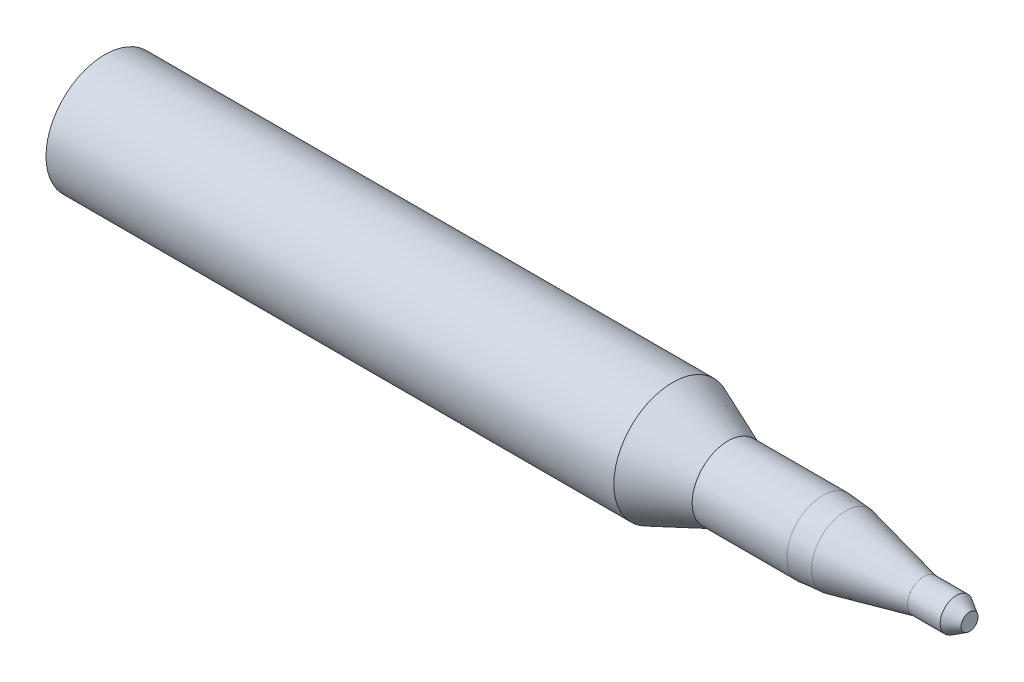
from build123d import *


with BuildPart() as part:
    # Sketch2 → Revolve1 (revolve)
    with BuildSketch(Plane.XY, mode=Mode.PRIVATE) as revolve1_sk:
        Polygon((0, 0), (1325, 0), (1325, 13), (1305, 25), (1285, 25), (1255, 25), (1135, 52.063697532), (1100, 55), (955, 55), (870, 90), (0, 90), align=None)
    revolve(revolve1_sk.sketch.rotate(Axis((0, 0, 0), (1, 0, 0)), 90), axis=Axis((0, 0, 0), (1, 0, 0)))


solid = part.part
